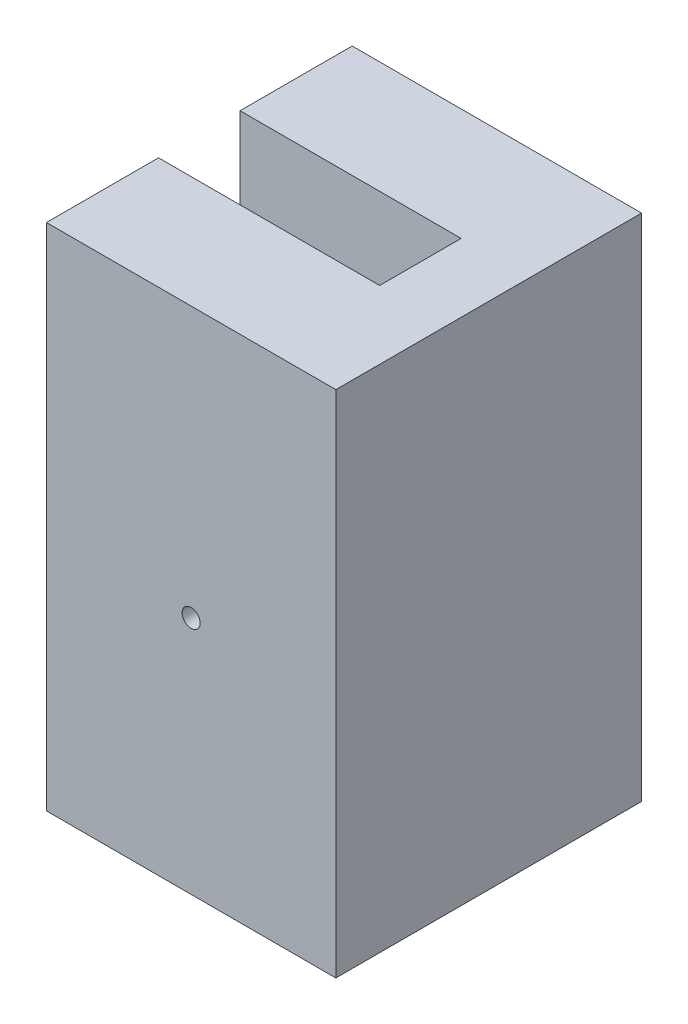
from build123d import *

# Parameters (mm, degrees)
SKETCH1_W               = 36.068
SKETCH1_H               = 38.1
BOSS_EXTRUDE1_DEPTH     = 63.5
SKETCH3_W               = 36.068
SKETCH3_H               = 10.16
CUT_EXTRUDE1_DEPTH      = 38.1
SKETCH4_W               = 36.068
SKETCH4_H               = 17.145
CUT_EXTRUDE2_DEPTH      = 19.05
SKETCH5_W               = 17.399
SKETCH5_H               = 10.16
CUT_EXTRUDE3_DEPTH      = 47.257298408
CUT_EXTRUDE4_DEPTH      = 71.283227416
CUT_EXTRUDE4_DEPTH_BACK = 71.283227416
SKETCH6_R               = 1.125
BOSS_EXTRUDE2_REACH     = 70.705
SKETCH7_W               = 8.509
SKETCH7_H               = 38.1
SKETCH8_W               = 10.16
SKETCH8_H               = 6.35
BOSS_EXTRUDE3_DEPTH     = 8.89


with BuildPart() as part:
    # Sketch1 → Boss-Extrude1 (new body)
    with BuildSketch(Plane(origin=(0, 0, 0), x_dir=(1, 0, 0), z_dir=(0, 1, 0))):
        Rectangle(SKETCH1_W, SKETCH1_H)
    extrude(amount=BOSS_EXTRUDE1_DEPTH)

    # Sketch3 → Cut-Extrude1 (cut)
    with BuildSketch(Plane(origin=(0, 63.5, 0), x_dir=(1, 0, 0), z_dir=(0, 1, 0))):
        Rectangle(SKETCH3_W, SKETCH3_H)
    extrude(amount=-CUT_EXTRUDE1_DEPTH, mode=Mode.SUBTRACT)

    # Sketch4 → Cut-Extrude2 (cut)
    with BuildSketch(Plane.XZ):
        Rectangle(SKETCH4_W, SKETCH4_H)
    extrude(amount=-CUT_EXTRUDE2_DEPTH, mode=Mode.SUBTRACT)

    # Sketch5 → Cut-Extrude3 (cut, through all)
    with BuildSketch(Plane(origin=(0, 25.4, 0), x_dir=(1, 0, 0), z_dir=(0, 1, 0))):
        with Locations((-9.3345, 0)):
            Rectangle(SKETCH5_W, SKETCH5_H)
        with Locations((9.3345, 0)):
            Rectangle(SKETCH5_W, SKETCH5_H)
    extrude(amount=-CUT_EXTRUDE3_DEPTH, mode=Mode.SUBTRACT)

    # Sketch6 → Cut-Extrude4 (cut, two sides: drawn at the far end of the back side and taken through both)
    with BuildSketch(Plane.XY.offset(-5.08).offset(-CUT_EXTRUDE4_DEPTH_BACK)):
        with Locations((0, 29.845)):
            Circle(SKETCH6_R)
    extrude(amount=CUT_EXTRUDE4_DEPTH + CUT_EXTRUDE4_DEPTH_BACK, mode=Mode.SUBTRACT)

    # Boss-Extrude2: up to this face of the body (flat: up to its plane)
    boss_extrude2_end = Plane(part.part.faces().sort_by_distance((0, 0, 13.81125))[0])
    # Sketch7 → Boss-Extrude2 (add, up to the picked face)
    with BuildSketch(Plane(origin=(0, 63.5, 0), x_dir=(1, 0, 0), z_dir=(0, 1, 0)), mode=Mode.PRIVATE) as boss_extrude2_sk1:
        with Locations((13.7795, 0)):
            Rectangle(SKETCH7_W, SKETCH7_H)
    boss_extrude2_tool1 = split(extrude(boss_extrude2_sk1.sketch, amount=-BOSS_EXTRUDE2_REACH, mode=Mode.PRIVATE), bisect_by=boss_extrude2_end, keep=Keep.BOTH, mode=Mode.PRIVATE)
    add(boss_extrude2_tool1.solids().sort_by(Axis((13.7795, 63.5, 0), (0, -1, 0)))[0])

    # Sketch8 → Boss-Extrude3 (add)
    with BuildSketch(Plane(origin=(0.635, 0, 0), x_dir=(0, 0, -1), z_dir=(1, 0, 0))):
        with Locations((0, 22.225)):
            Rectangle(SKETCH8_W, SKETCH8_H)
    extrude(amount=BOSS_EXTRUDE3_DEPTH)


solid = part.part
